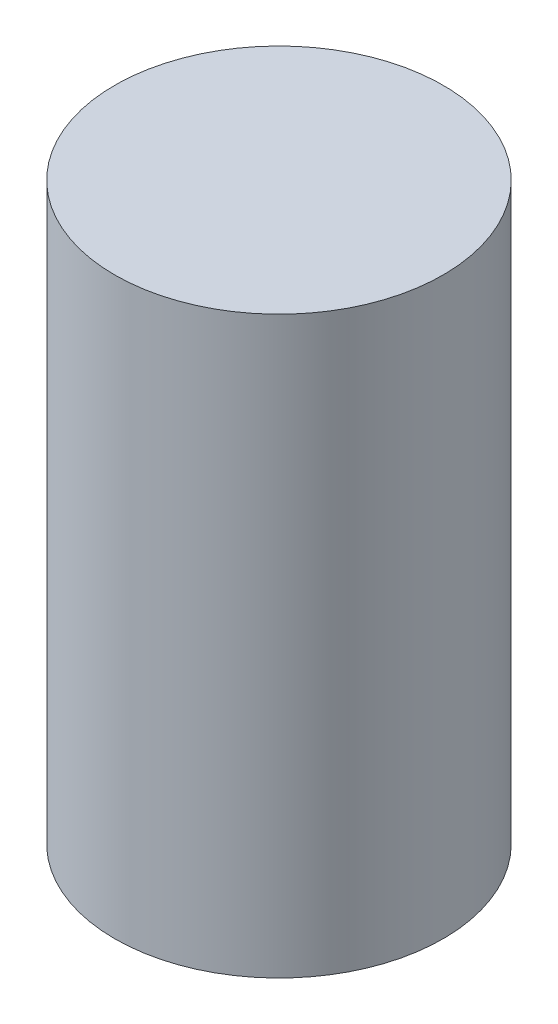
from build123d import *

# Parameters (mm, degrees)
SKETCH1_R           = 20
BOSS_EXTRUDE1_DEPTH = 70


with BuildPart() as part:
    # Sketch1 → Boss-Extrude1 (new body)
    with BuildSketch(Plane(origin=(0, 0, 0), x_dir=(1, 0, 0), z_dir=(0, 1, 0))):
        with Locations(Location((0, 0, 0), (0, 0, 270))):
            Circle(SKETCH1_R)
    extrude(amount=BOSS_EXTRUDE1_DEPTH)


solid = part.part
